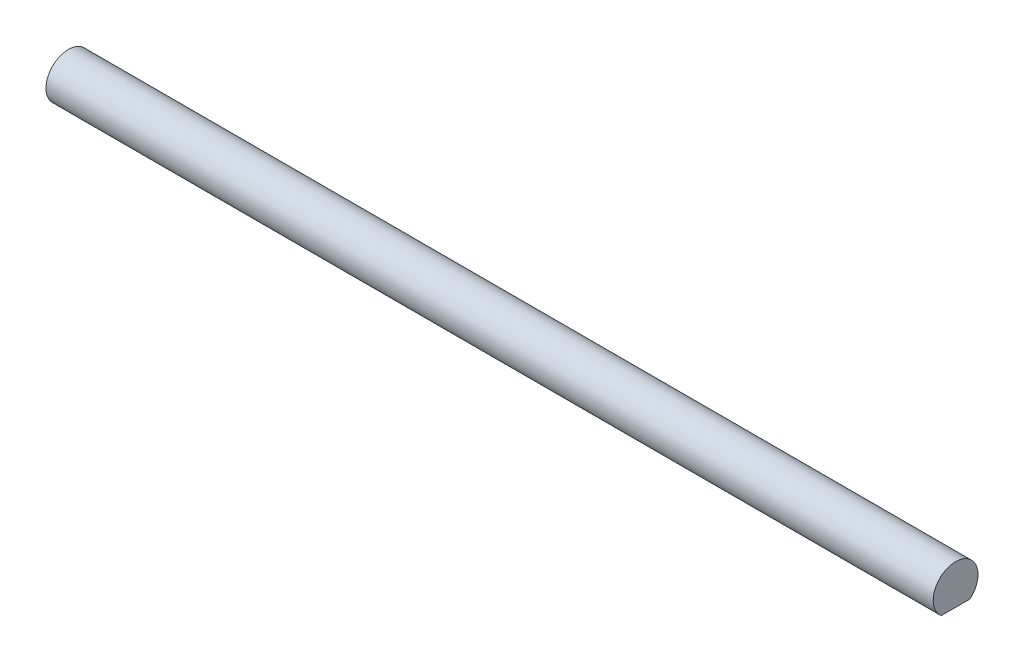
from build123d import *

# Parameters (mm, degrees)
BOSS_EXTRUDE1_DEPTH = 304.8
CUT_EXTRUDE3_START  = -179.07
SKETCH4_R           = 3.175
CUT_EXTRUDE3_DEPTH  = 179.07


with BuildPart() as part:
    # Sketch1 → Boss-Extrude1 (new body)
    with BuildSketch(Plane(origin=(0, 0, 0), x_dir=(0, 0, -1), z_dir=(1, 0, 0))):
        with BuildLine():
            ThreePointArc((3.175, 0), (-1.347038418, 2.875084781), (-2.032, -2.439590334))
            Line((-2.032, -2.439590334), (2.032, -2.439590334))
            ThreePointArc((2.032, -2.439590334), (2.875084781, -1.347038418), (3.175, 0))
        make_face()
    extrude(amount=BOSS_EXTRUDE1_DEPTH)

    # Sketch4 → Cut-Extrude3 (cut)
    with BuildSketch(Plane(origin=(304.8, 0, 0), x_dir=(0, 0, -1), z_dir=(1, 0, 0)).offset(CUT_EXTRUDE3_START)):
        Circle(SKETCH4_R)
    extrude(amount=CUT_EXTRUDE3_DEPTH, mode=Mode.SUBTRACT)


solid = part.part
